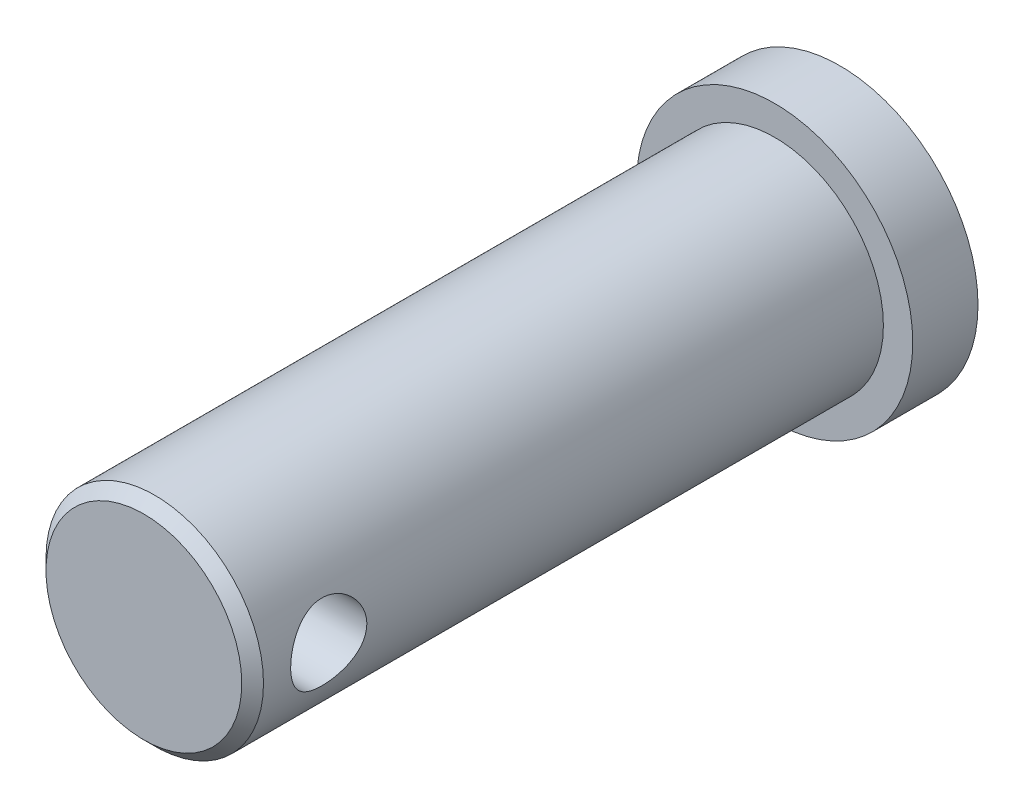
from build123d import *

# Parameters (mm, degrees)
ESBO_O1_R             = 5
EXTRUS_O1_DEPTH       = 29
ESBO_O1_3_R           = 6.35
EXTRUS_O2_DEPTH       = 3
ESBO_O2_R             = 1.75
CORTE_EXTRUS_O1_DEPTH = 7.5
CHANFRO1_SIZE         = 0.5


with BuildPart() as part:
    # Esboço1 → Extrusão1 (new body)
    with BuildSketch(Plane.XY):
        Circle(ESBO_O1_R)
    extrude(amount=EXTRUS_O1_DEPTH)

    # Esboço1<3> → Extrusão2 (add)
    with BuildSketch(Plane.XY):
        Circle(ESBO_O1_3_R)
    extrude(amount=-EXTRUS_O2_DEPTH)

    # Esboço2 → Corte-extrusão1 (cut, symmetric)
    with BuildSketch(Plane(origin=(0, 0, 0), x_dir=(0, 0, -1), z_dir=(1, 0, 0))):
        with Locations((-25.5, 0)):
            Circle(ESBO_O2_R)
    extrude(amount=CORTE_EXTRUS_O1_DEPTH, both=True, mode=Mode.SUBTRACT)

    # Chanfro1
    chanfro1_edges = [part.edges().sort_by_distance(p)[0] for p in [
        (-5, 0, 29),
    ]]
    chamfer(chanfro1_edges, length=CHANFRO1_SIZE)


solid = part.part
